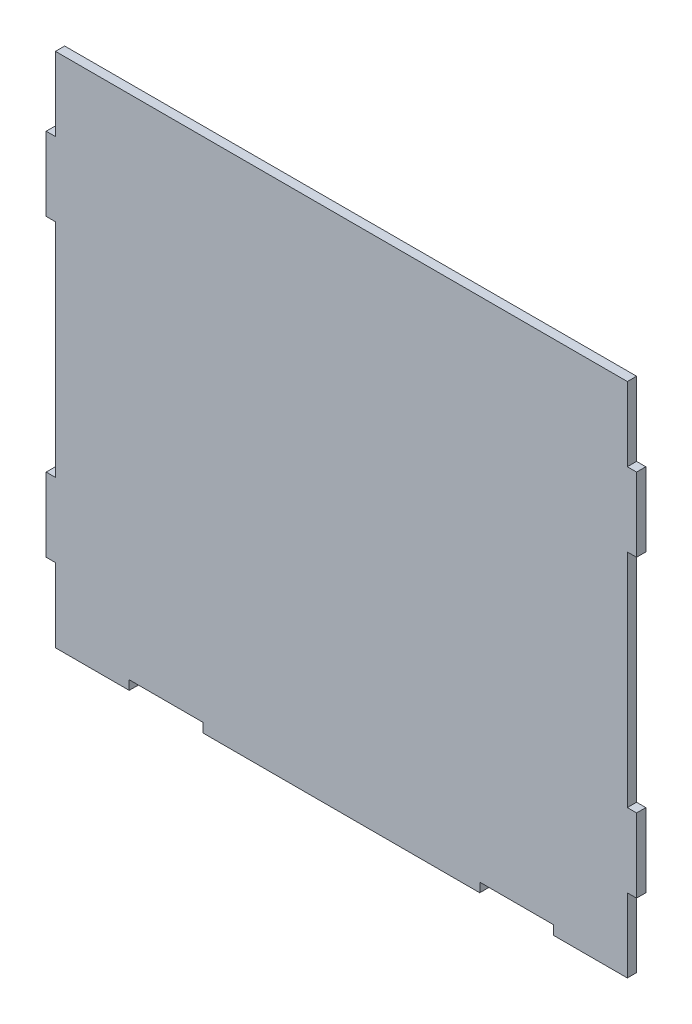
from build123d import *

# Parameters (mm, degrees)
BOSS_EXTRUDE1_DEPTH = 3.175


with BuildPart() as part:
    # Sketch1 → Boss-Extrude1 (new body)
    with BuildSketch(Plane.XY):
        Polygon((0, 177.8), (0, 152.4), (-3.175, 152.4), (-3.175, 127), (0, 127), (0, 50.8), (-3.175, 50.8), (-3.175, 25.4), (0, 25.4), (0, 0), (25.4, 0), (25.4, 3.175), (50.8, 3.175), (50.8, 0), (146.05, 0), (146.05, 3.175), (171.45, 3.175), (171.45, 0), (196.85, 0), (196.85, 25.4), (200.025, 25.4), (200.025, 50.8), (196.85, 50.8), (196.85, 127), (200.025, 127), (200.025, 152.4), (196.85, 152.4), (196.85, 177.8), align=None)
    extrude(amount=BOSS_EXTRUDE1_DEPTH)


solid = part.part
